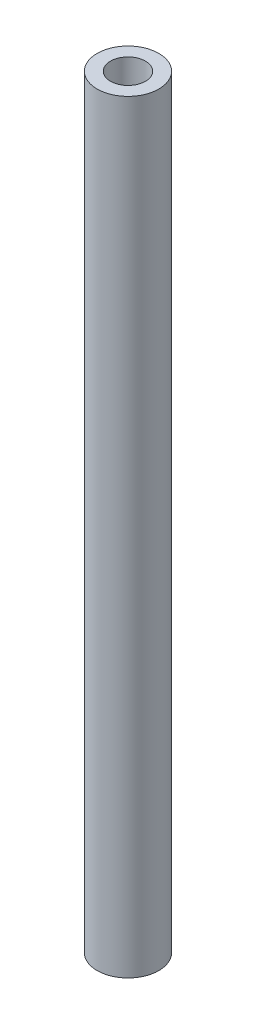
from build123d import *

# Parameters (mm, degrees)
SKETCH1_R           = 2.425
BOSS_EXTRUDE1_DEPTH = 60
SKETCH2_R           = 1.375
CUT_EXTRUDE1_DEPTH  = 11
CUT_EXTRUDE2_START  = -49
SKETCH2_2_R         = 1.375
CUT_EXTRUDE2_DEPTH  = 11


with BuildPart() as part:
    # Sketch1 → Boss-Extrude1 (new body)
    with BuildSketch(Plane(origin=(0, 0, 0), x_dir=(1, 0, 0), z_dir=(0, 1, 0))):
        with Locations(Location((0, 0, 0), (0, 0, 270))):
            Circle(SKETCH1_R)
    extrude(amount=BOSS_EXTRUDE1_DEPTH)

    # Sketch2 → Cut-Extrude1 (cut)
    with BuildSketch(Plane(origin=(0, 60, 0), x_dir=(1, 0, 0), z_dir=(0, 1, 0))):
        with Locations(Location((0, 0, 0), (0, 0, 270))):
            Circle(SKETCH2_R)
    extrude(amount=-CUT_EXTRUDE1_DEPTH, mode=Mode.SUBTRACT)

    # Sketch2<2> → Cut-Extrude2 (cut)
    with BuildSketch(Plane(origin=(0, 60, 0), x_dir=(1, 0, 0), z_dir=(0, 1, 0)).offset(CUT_EXTRUDE2_START)):
        with Locations(Location((0, 0, 0), (0, 0, 270))):
            Circle(SKETCH2_2_R)
    extrude(amount=-CUT_EXTRUDE2_DEPTH, mode=Mode.SUBTRACT)


solid = part.part
